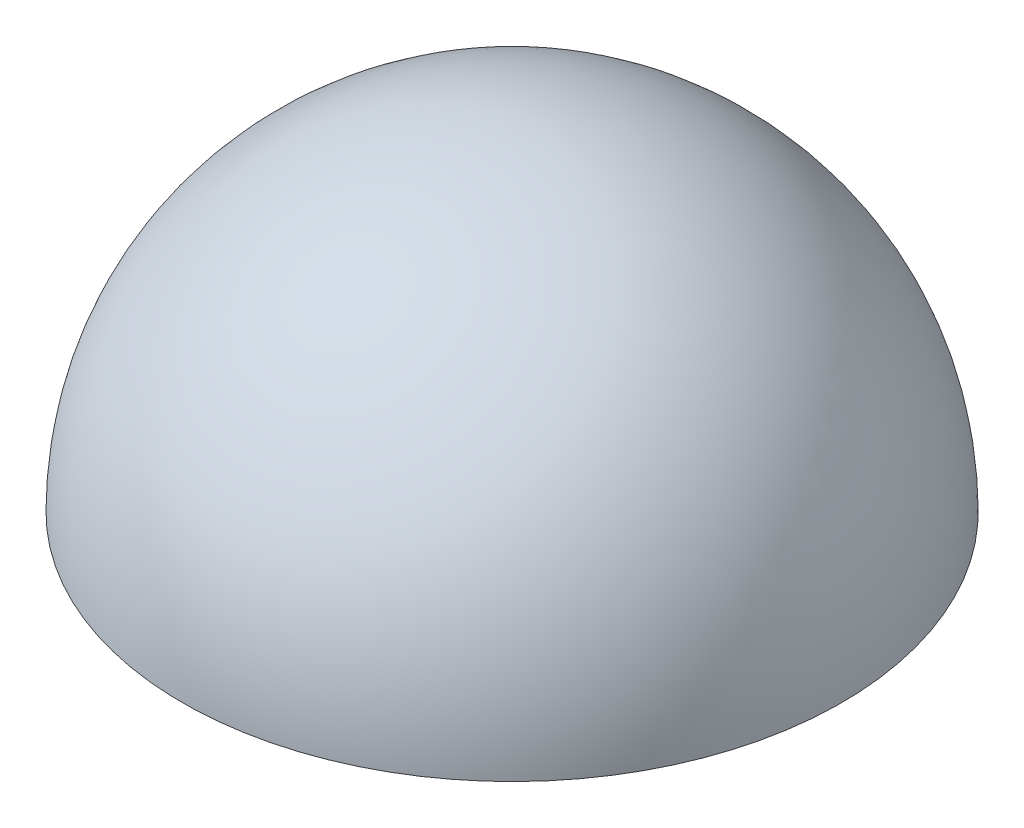
from build123d import *

# Parameters (mm, degrees)
REVOLVE_1_ANGLE = 180
SHELL_3_T       = -3


with BuildPart() as part:
    # 草图1 → 旋转1 (revolve)
    with BuildSketch(Plane(origin=(0, 0, 0), x_dir=(1, 0, 0), z_dir=(0, 1, 0))):
        with BuildLine():
            Line((0, 0), (0, -94))
            ThreePointArc((0, -94), (47, -47), (0, 0))
        make_face()
    revolve(axis=Axis((0, 0, 0), (0, 0, 1)), revolution_arc=REVOLVE_1_ANGLE)

    # 抽壳3
    shell_3_openings = [part.faces().sort_by_distance(p)[0] for p in [
        (0, 0, 47),
    ]]
    offset(amount=SHELL_3_T, openings=shell_3_openings)


solid = part.part
